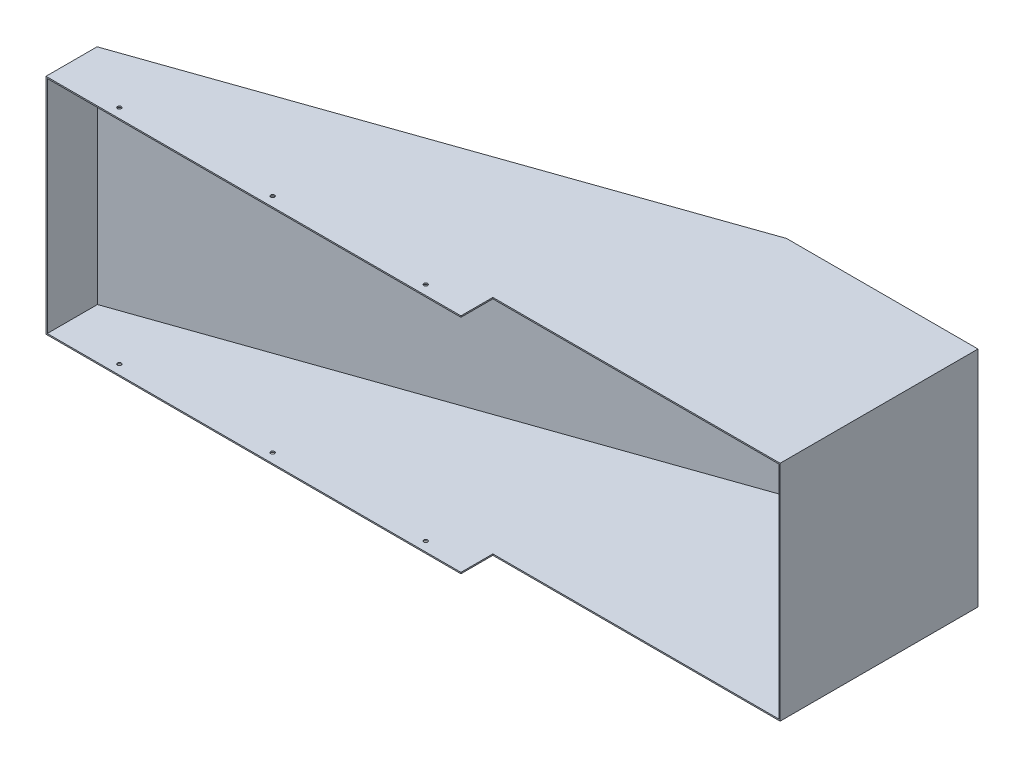
from build123d import *

# Parameters (mm, degrees)
SKETCH7_W           = 800
SKETCH7_H           = 350
BOSS_EXTRUDE1_DEPTH = 360
CUT_EXTRUDE1_DEPTH  = 642.950153828
SKETCH10_W          = 150
SKETCH10_H          = 50
CUT_EXTRUDE3_DEPTH  = 642.950153828
SKETCH11_W          = 310
SKETCH11_H          = 350
BOSS_EXTRUDE2_DEPTH = 300
SHELL3_T            = -2
SKETCH12_R          = 3
CUT_EXTRUDE4_DEPTH  = 862.452262171


with BuildPart() as part:
    # Sketch7 → Boss-Extrude1 (new body)
    with BuildSketch(Plane.XY):
        Rectangle(SKETCH7_W, SKETCH7_H)
    extrude(amount=BOSS_EXTRUDE1_DEPTH)

    # Sketch8 → Cut-Extrude1 (cut, through all)
    with BuildSketch(Plane.XZ.offset(175)):
        Polygon((-400, 280), (400, 0), (-400, 0), align=None)
    extrude(amount=-CUT_EXTRUDE1_DEPTH, mode=Mode.SUBTRACT)

    # Sketch10 → Cut-Extrude3 (cut, through all)
    with BuildSketch(Plane.XZ.offset(175)):
        with Locations((325, 335)):
            Rectangle(SKETCH10_W, SKETCH10_H)
    extrude(amount=-CUT_EXTRUDE3_DEPTH, mode=Mode.SUBTRACT)

    # Sketch11 → Boss-Extrude2 (add)
    with BuildSketch(Plane(origin=(400, 0, 0), x_dir=(0, 0, -1), z_dir=(1, 0, 0))):
        with Locations((-155, 0)):
            Rectangle(SKETCH11_W, SKETCH11_H)
    extrude(amount=BOSS_EXTRUDE2_DEPTH)

    # Shell3
    shell3_openings = [part.faces().sort_by_distance(p)[0] for p in [
        (-75, 0, 360),
        (475, 0, 310),
        (250, 0, 335),
    ]]
    offset(amount=SHELL3_T, openings=shell3_openings, kind=Kind.INTERSECTION)

    # Sketch12 → Cut-Extrude4 (cut, through all)
    with BuildSketch(Plane.XZ.offset(175)):
        with Locations(Location((-300, 345, 0), (0, 0, 270))):
            Circle(SKETCH12_R)
        with Locations(Location((-60, 345, 0), (0, 0, 270))):
            Circle(SKETCH12_R)
        with Locations(Location((180, 345, 0), (0, 0, 270))):
            Circle(SKETCH12_R)
    extrude(amount=-CUT_EXTRUDE4_DEPTH, mode=Mode.SUBTRACT)


solid = part.part
